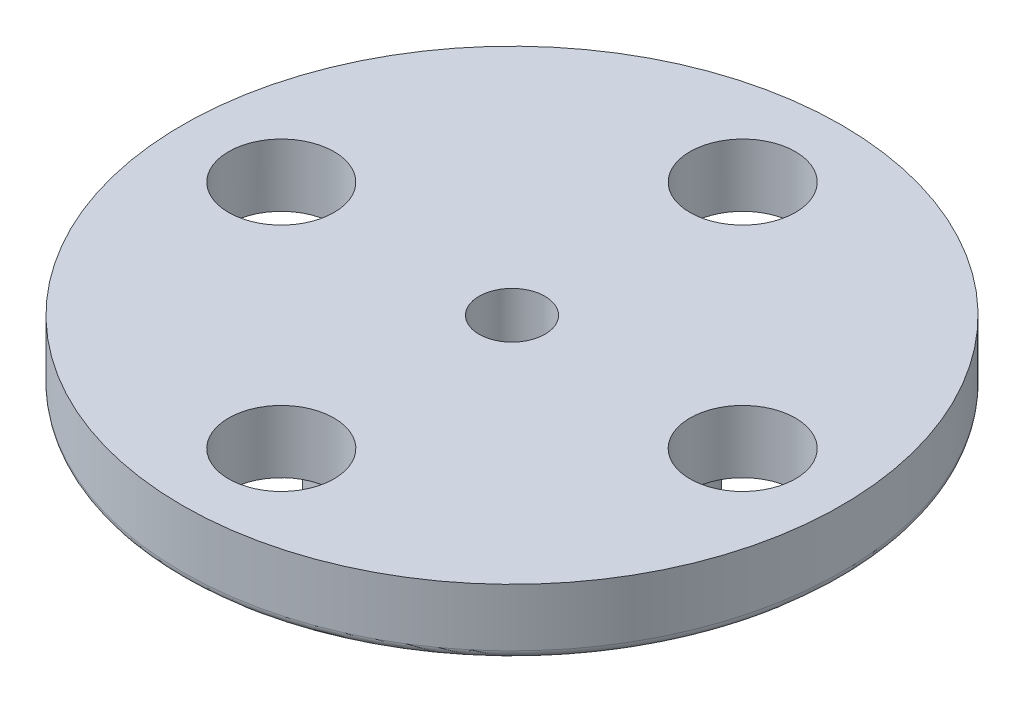
from build123d import *

# Parameters (mm, degrees)
SKETCH1_R           = 10
BOSS_EXTRUDE1_DEPTH = 2
SKETCH2_R           = 4.5
BOSS_EXTRUDE2_DEPTH = 2.5
FILLET1_R           = 0.25
SKETCH6_R           = 1
CUT_EXTRUDE2_DEPTH  = 15.840822214
SKETCH7_R           = 2.9
CUT_EXTRUDE3_DEPTH  = 2.5
BOSS_EXTRUDE4_DEPTH = 2.5
CIRPATTERN1_COUNT   = 26
SKETCH3_R           = 1.6
CUT_EXTRUDE4_DEPTH  = 15.361406756
SKETCH9_R           = 3.25
CUT_EXTRUDE5_DEPTH  = 2.6


with BuildPart() as part:
    # Sketch1 → Boss-Extrude1 (new body)
    with BuildSketch(Plane(origin=(0, 0, 0), x_dir=(1, 0, 0), z_dir=(0, 1, 0))):
        with Locations(Location((0, 0, 0), (0, 0, 270))):
            Circle(SKETCH1_R)
    extrude(amount=BOSS_EXTRUDE1_DEPTH)

    # Sketch2 → Boss-Extrude2 (add)
    with BuildSketch(Plane(origin=(0, 0, 0), x_dir=(1, 0, 0), z_dir=(0, 1, 0))):
        with Locations(Location((0, 0, 0), (0, 0, 270))):
            Circle(SKETCH2_R)
    extrude(amount=-BOSS_EXTRUDE2_DEPTH)

    # Fillet1
    fillet1_edges = [part.edges().sort_by_distance(p)[0] for p in [
        (0, 0, -10),
    ]]
    fillet(fillet1_edges, radius=FILLET1_R)

    # Sketch6 → Cut-Extrude2 (cut, through all)
    with BuildSketch(Plane(origin=(0, 2, 0), x_dir=(1, 0, 0), z_dir=(0, 1, 0))):
        with Locations(Location((0, 0, 0), (0, 0, 270))):
            Circle(SKETCH6_R)
    extrude(amount=-CUT_EXTRUDE2_DEPTH, mode=Mode.SUBTRACT)

    # Sketch7 → Cut-Extrude3 (cut)
    with BuildSketch(Plane.XZ.offset(2.5)):
        with Locations(Location((0, 0, 0), (0, 0, 270))):
            Circle(SKETCH7_R)
    extrude(amount=-CUT_EXTRUDE3_DEPTH, mode=Mode.SUBTRACT)

    # Sketch8 → Boss-Extrude4 (add)
    with BuildSketch(Plane.XZ.offset(2.5)):
        with BuildLine():
            Line((-2.35244742, -1.046531787), (-2.745588284, -0.933672842))
            ThreePointArc((-2.745588284, -0.933672842), (-2.649635472, -1.178741646), (-2.531859978, -1.414102207))
            Line((-2.531859978, -1.414102207), (-2.35244742, -1.046531787))
        make_face()
    boss_extrude4 = extrude(amount=-BOSS_EXTRUDE4_DEPTH)

    # CirPattern1: Boss-Extrude4 ×26 about axis
    cirpattern1_axis = Axis((0, 0, 0), (0, 1, 0))
    for i in range(1, CIRPATTERN1_COUNT):
        add(boss_extrude4.rotate(cirpattern1_axis, i * 360 / CIRPATTERN1_COUNT))

    # Sketch3 → Cut-Extrude4 (cut, through all)
    with BuildSketch(Plane(origin=(0, 0, 0), x_dir=(1, 0, 0), z_dir=(0, 1, 0))):
        with Locations(Location((0, 7, 0), (0, 0, 270))):
            Circle(SKETCH3_R)
        with Locations(Location((-7, 0, 0), (0, 0, 270))):
            Circle(SKETCH3_R)
        with Locations(Location((0, -7, 0), (0, 0, 90))):
            Circle(SKETCH3_R)
        with Locations(Location((7, 0, 0), (0, 0, 90))):
            Circle(SKETCH3_R)
    extrude(amount=CUT_EXTRUDE4_DEPTH, mode=Mode.SUBTRACT)

    # Sketch9 → Cut-Extrude5 (cut)
    with BuildSketch(Plane.XZ.offset(2.5)):
        with Locations((7, 0)):
            Circle(SKETCH9_R)
        with Locations((0, -7)):
            Circle(SKETCH9_R)
        with Locations((-7, 0)):
            Circle(SKETCH9_R)
        with Locations((0, 7)):
            Circle(SKETCH9_R)
    extrude(amount=-CUT_EXTRUDE5_DEPTH, mode=Mode.SUBTRACT)


solid = part.part
